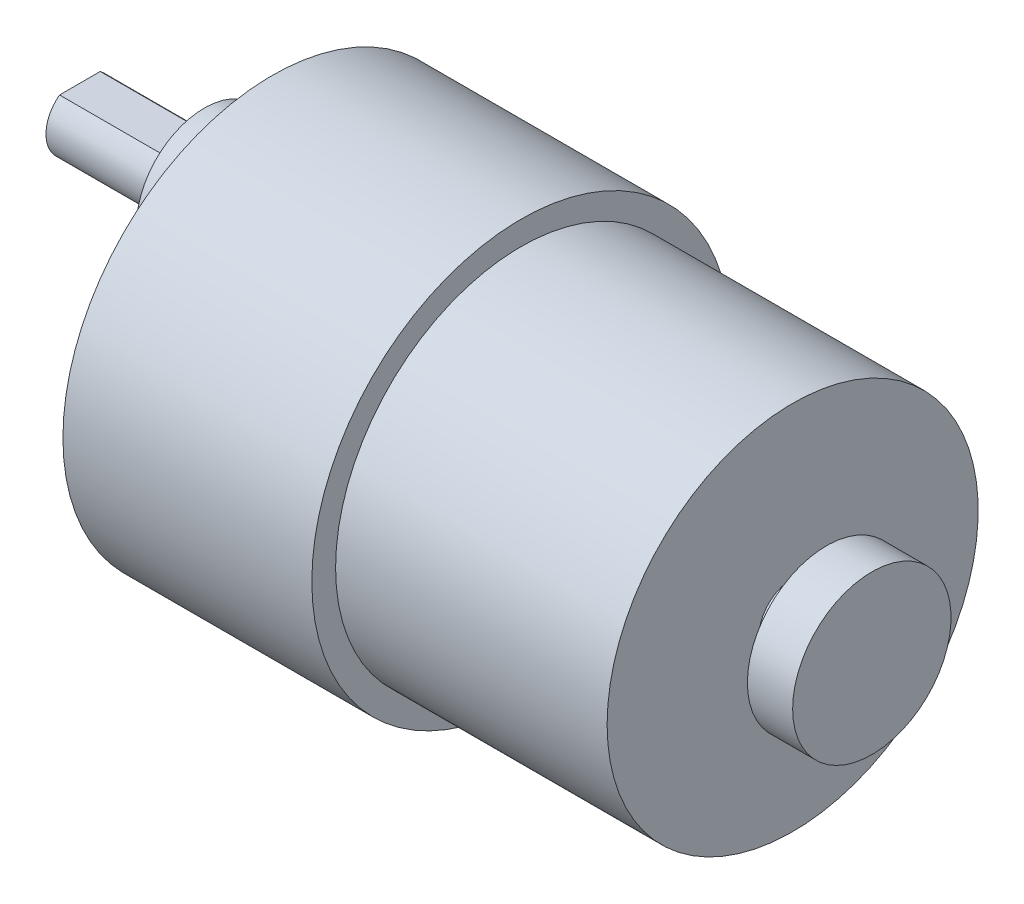
from build123d import *

# Parameters (mm, degrees)
SKETCH_2_R      = 6
EXTRUDE_1_DEPTH = 6
EXTRUDE_2_DEPTH = 11


with BuildPart() as part:
    # 草图1 → 旋转1 (revolve)
    with BuildSketch(Plane(origin=(0, 0, 0), x_dir=(1, 0, 0), z_dir=(0, 1, 0)), mode=Mode.PRIVATE) as revolve_1_sk:
        Polygon((0, 18.5), (0, 0), (53, 0), (53, 7), (49, 7), (49, 3), (46, 3), (46, 16.4), (22, 16.4), (22, 18.5), align=None)
    revolve(revolve_1_sk.sketch.rotate(Axis((0, 0, 0), (1, 0, 0)), 180), axis=Axis((0, 0, 0), (1, 0, 0)))

    # 草图2 → 凸台-拉伸1 (add)
    with BuildSketch(Plane.ZY):
        with Locations((0, 7)):
            Circle(SKETCH_2_R)
    extrude(amount=EXTRUDE_1_DEPTH)

    # 草图3 → 凸台-拉伸2 (add)
    with BuildSketch(Plane.ZY.offset(6)):
        with BuildLine():
            Line((-1.8, 9.4), (1.8, 9.4))
            ThreePointArc((1.8, 9.4), (0, 4), (-1.8, 9.4))
        make_face()
    extrude(amount=EXTRUDE_2_DEPTH)


solid = part.part
